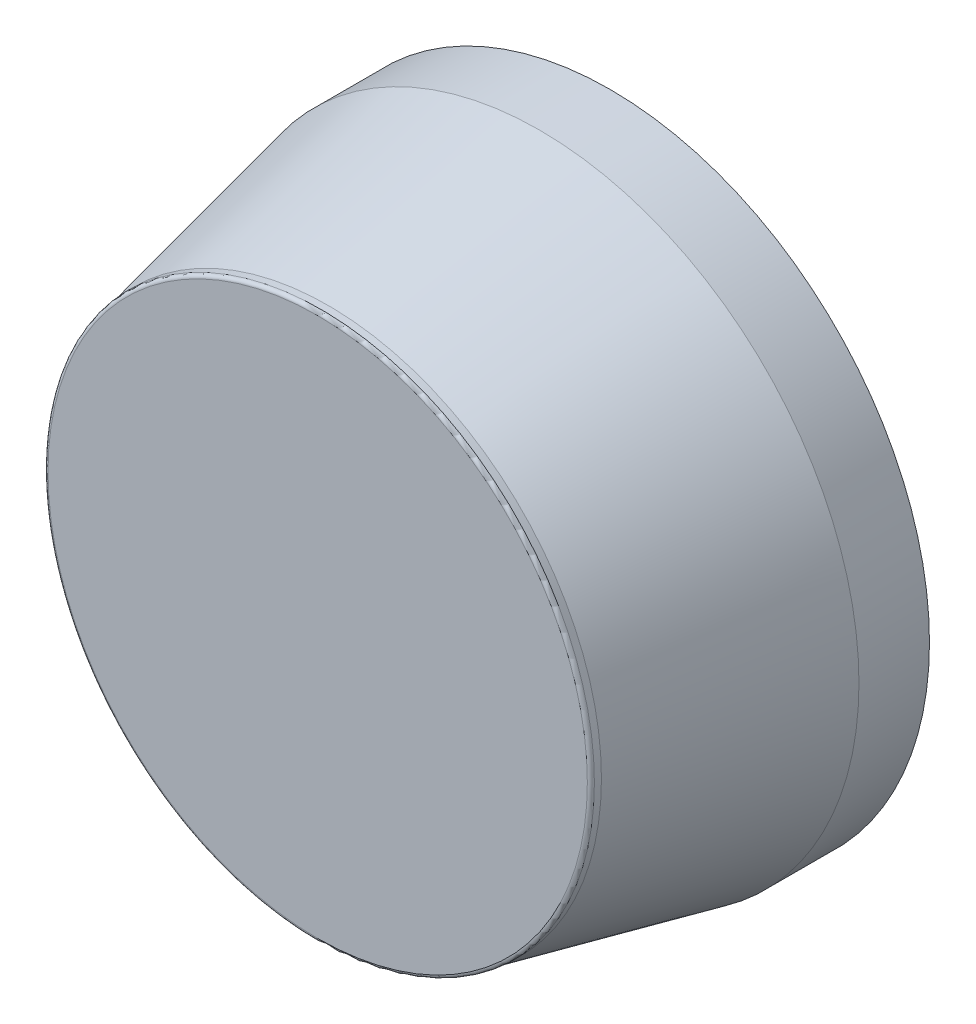
from build123d import *

# Parameters (mm, degrees)
SKETCH2_R                       = 77.5
SKETCH1_R                       = 90.55
SKETCH4_R                       = 74.5
SKETCH3_R                       = 87.05
SKETCH5_R                       = 77.5
BOSS_EXTRUDE1_DEPTH             = 3
SKETCH7_R                       = 20
CUT_EXTRUDE1_DEPTH              = 159
BOSS_EXTRUDE4_REACH             = 144.715
SKETCH9_W                       = 30.851346151
SKETCH9_H                       = 7.25914027
BOSS_EXTRUDE4_DIRECTION_2_REACH = 144.715
FILLET2_R                       = 1
SKETCH1_7_R                     = 90.55
SKETCH1_7_R_2                   = 87.55
BOSS_EXTRUDE6_DEPTH             = 20


with BuildPart() as part:
    # Sketch2 → Loft2 section 0
    with BuildSketch(Plane.XY.offset(60)):
        Circle(SKETCH2_R)
    # Sketch1 → Loft2 section 1
    with BuildSketch(Plane.XY):
        Circle(SKETCH1_R)
    loft()

    # Sketch4 → Cut-Loft1 section 0
    with BuildSketch(Plane.XY.offset(60)):
        Circle(SKETCH4_R)
    # Sketch3 → Cut-Loft1 section 1
    with BuildSketch(Plane(origin=(0, 0, 0), x_dir=(-1, 0, 0), z_dir=(0, 0, -1))):
        Circle(SKETCH3_R)
    loft(mode=Mode.SUBTRACT)

    # Sketch5 → Boss-Extrude1 (add)
    with BuildSketch(Plane.XY.offset(60)):
        Circle(SKETCH5_R)
    extrude(amount=BOSS_EXTRUDE1_DEPTH)

    # Sketch7 → Cut-Extrude1 (cut)
    with BuildSketch(Plane(origin=(0, 0, 0), x_dir=(1, 0, 0), z_dir=(0, 1, 0))):
        with Locations((0, -36.396883827)):
            Circle(SKETCH7_R)
    extrude(amount=-CUT_EXTRUDE1_DEPTH, mode=Mode.SUBTRACT)

    # Boss-Extrude4: up to this cone (the profile starts inside it)
    boss_extrude4_end = Plane(origin=(0, 0, 35.178058), z_dir=(0, 0, -1)) * Cone(32.648891502, 126.734954235, 449.813845737, mode=Mode.PRIVATE)
    # Sketch9 → Boss-Extrude4 (add, up to the surface)
    with BuildSketch(Plane(origin=(0, 0, 0), x_dir=(0, 0, -1), z_dir=(1, 0, 0)), mode=Mode.PRIVATE) as boss_extrude4_sk1:
        with Locations((-35.178058342, 0)):
            Rectangle(SKETCH9_W, SKETCH9_H)
    boss_extrude4_tool1 = extrude(boss_extrude4_sk1.sketch, amount=BOSS_EXTRUDE4_REACH, mode=Mode.PRIVATE) & boss_extrude4_end
    add(boss_extrude4_tool1.solids().sort_by_distance((0, 0, 35.178058))[0])

    # Boss-Extrude4 direction 2: up to this cone (the profile starts inside it)
    boss_extrude4_direction_2_end = Plane(origin=(0, 0, 35.178058), z_dir=(0, 0, -1)) * Cone(32.648891502, 126.734954235, 449.813845737, mode=Mode.PRIVATE)
    # Sketch9 → Boss-Extrude4 direction 2 (add, up to the surface)
    with BuildSketch(Plane(origin=(0, 0, 0), x_dir=(0, 0, -1), z_dir=(1, 0, 0)), mode=Mode.PRIVATE) as boss_extrude4_direction_2_sk1:
        with Locations((-35.178058342, 0)):
            Rectangle(SKETCH9_W, SKETCH9_H)
    boss_extrude4_direction_2_tool1 = extrude(boss_extrude4_direction_2_sk1.sketch, amount=-BOSS_EXTRUDE4_DIRECTION_2_REACH, mode=Mode.PRIVATE) & boss_extrude4_direction_2_end
    add(boss_extrude4_direction_2_tool1.solids().sort_by_distance((0, 0, 35.178058))[0])

    # Fillet2
    fillet2_edges = [part.edges().sort_by_distance(p)[0] for p in [
        (-77.5, 0, 63),
    ]]
    fillet(fillet2_edges, radius=FILLET2_R)

    # Sketch1<7> → Boss-Extrude6 (add)
    with BuildSketch(Plane.XY):
        Circle(SKETCH1_7_R)
        Circle(SKETCH1_7_R_2, mode=Mode.SUBTRACT)
    extrude(amount=-BOSS_EXTRUDE6_DEPTH)


solid = part.part
